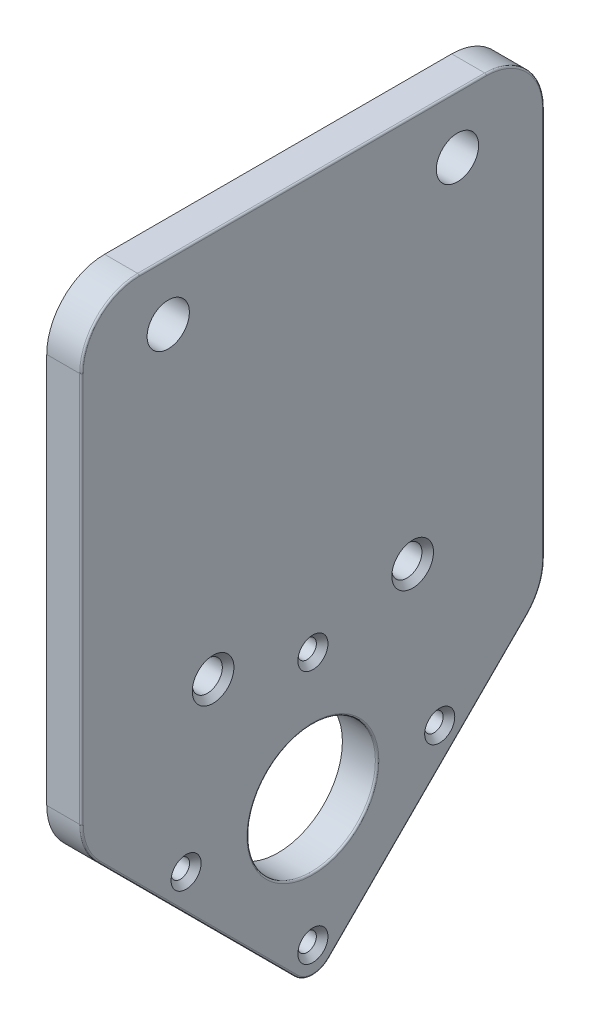
from build123d import *

# Parameters (mm, degrees)
SKETCH_2_R      = 1.6
SKETCH_2_R_2    = 2.6
SKETCH_2_R_3    = 11.1
SKETCH_2_R_4    = 3.655
EXTRUDE_1_DEPTH = 6
FILLET_1_R      = 0.3
CHAMFER_1_SIZE  = 1


with BuildPart() as part:
    # Эскиз2 → Бобышка-Вытянуть1 (new body)
    with BuildSketch(Plane(origin=(0, 0, 0), x_dir=(0, 0, -1), z_dir=(1, 0, 0))):
        with BuildLine():
            Line((-30, 47.1129), (30, 47.1129))
            ThreePointArc((30, 47.1129), (37.071067812, 44.183967812), (40, 37.1129))
            Line((40, 37.1129), (40, -30.391408151))
            ThreePointArc((40, -30.391408151), (39.238795325, -34.218242474), (37.071067812, -37.462475962))
            Line((37.071067812, -37.462475962), (2.828427125, -71.70511665))
            ThreePointArc((2.828427125, -71.70511665), (0, -72.876689525), (-2.828427125, -71.70511665))
            Line((-2.828427125, -71.70511665), (-37.071067812, -37.462475962))
            ThreePointArc((-37.071067812, -37.462475962), (-39.238795325, -34.218242474), (-40, -30.391408151))
            Line((-40, -30.391408151), (-40, 37.1129))
            ThreePointArc((-40, 37.1129), (-37.071067812, 44.183967812), (-30, 47.1129))
        make_face()
        with Locations((-21.913410217, -46.3871)):
            Circle(SKETCH_2_R, mode=Mode.SUBTRACT)
        with Locations((17.25, -19.8871)):
            Circle(SKETCH_2_R_2, mode=Mode.SUBTRACT)
        with Locations((-17.25, -19.8871)):
            Circle(SKETCH_2_R_2, mode=Mode.SUBTRACT)
        with Locations((0.0069, -46.3871)):
            Circle(SKETCH_2_R_3, mode=Mode.SUBTRACT)
        with Locations((-25, 37.1129)):
            Circle(SKETCH_2_R_4, mode=Mode.SUBTRACT)
        with Locations((25, 37.1129)):
            Circle(SKETCH_2_R_4, mode=Mode.SUBTRACT)
        with Locations((0.0069, -24.466789783)):
            Circle(SKETCH_2_R, mode=Mode.SUBTRACT)
        with Locations((21.927210217, -46.3871)):
            Circle(SKETCH_2_R, mode=Mode.SUBTRACT)
        with Locations((0.0069, -68.307410217)):
            Circle(SKETCH_2_R, mode=Mode.SUBTRACT)
    extrude(amount=EXTRUDE_1_DEPTH)

    # Скругление1
    fillet_1_edges = [part.edges().sort_by_distance(p)[0] for p in [
        (6, 44.183967812, 37.071067812),
        (6, 3.360745925, 40),
        (6, -34.218242474, 39.238795325),
        (6, -54.583796306, 19.949747468),
        (6, -72.876689525, 0),
        (6, -54.583796306, -19.949747468),
        (6, -34.218242474, -39.238795325),
        (6, 3.360745925, -40),
        (6, 44.183967812, -37.071067812),
        (6, -46.3871, 11.0931),
        (6, 47.1129, 0),
    ]]
    fillet(fillet_1_edges, radius=FILLET_1_R)

    # Фаска1
    chamfer_1_edges = [part.edges().sort_by_distance(p)[0] for p in [
        (6, -24.466789783, 1.5931),
        (6, -46.3871, 23.513410217),
        (6, -46.3871, -20.327210217),
        (6, -68.307410217, 1.5931),
        (6, -19.8871, -14.65),
        (6, -19.8871, 19.85),
    ]]
    chamfer(chamfer_1_edges, length=CHAMFER_1_SIZE)


solid = part.part
